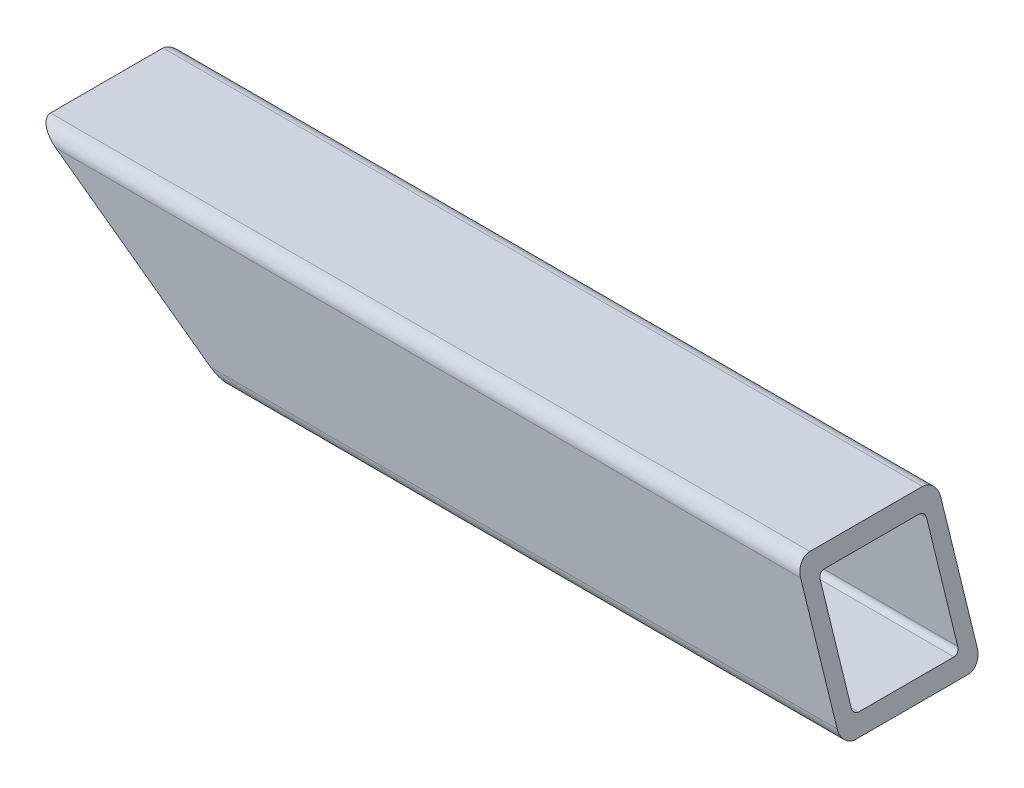
from build123d import *

# Parameters (mm, degrees)
SKETCH3_W           = 25.4
SKETCH3_H           = 25.4
SKETCH3_W_2         = 19.304
SKETCH3_H_2         = 19.304
BOSS_EXTRUDE1_DEPTH = 145.89
FILLET1_R           = 2.5
FILLET2_R           = 1
CUT_EXTRUDE1_DEPTH  = 149.628200891


with BuildPart() as part:
    # Sketch3 → Boss-Extrude1 (new body)
    with BuildSketch(Plane(origin=(0, 0, 0), x_dir=(0, 0, -1), z_dir=(1, 0, 0))):
        Rectangle(SKETCH3_W, SKETCH3_H)
        Rectangle(SKETCH3_W_2, SKETCH3_H_2, mode=Mode.SUBTRACT)
    extrude(amount=-BOSS_EXTRUDE1_DEPTH)

    # Fillet1
    fillet1_edges = [part.edges().sort_by_distance(p)[0] for p in [
        (-72.945, -12.7, -12.7),
        (-72.945, -12.7, 12.7),
        (-72.945, 12.7, 12.7),
        (-72.945, 12.7, -12.7),
    ]]
    fillet(fillet1_edges, radius=FILLET1_R)

    # Fillet2
    fillet2_edges = [part.edges().sort_by_distance(p)[0] for p in [
        (-72.945, 9.652, -9.652),
        (-72.945, -9.652, -9.652),
        (-72.945, -9.652, 9.652),
        (-72.945, 9.652, 9.652),
    ]]
    fillet(fillet2_edges, radius=FILLET2_R)

    # Sketch5 → Cut-Extrude1 (cut, through all)
    with BuildSketch(Plane(origin=(0, 0, -12.7), x_dir=(-1, 0, 0), z_dir=(0, 0, -1))):
        Polygon((145.89, 12.7), (110.92989922, -12.7), (145.89, -12.7), align=None)
        Polygon((0, 12.7), (8.252960284, 12.7), (0, -12.7), align=None)
    extrude(amount=-CUT_EXTRUDE1_DEPTH, mode=Mode.SUBTRACT)


solid = part.part
